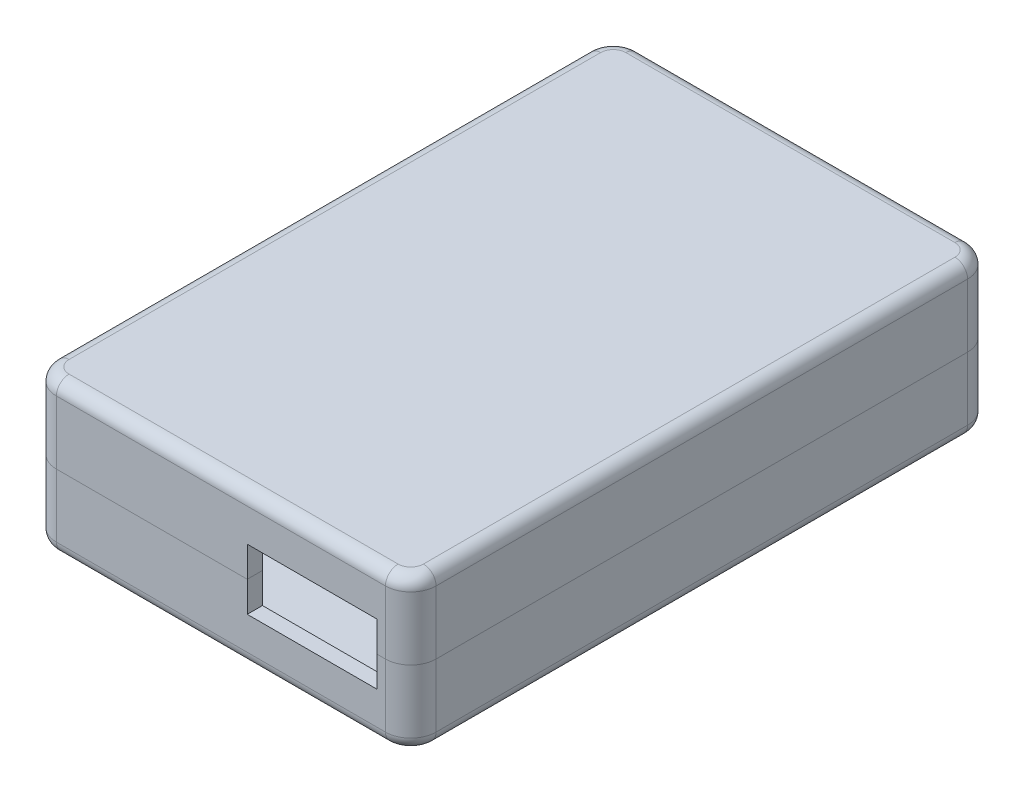
from build123d import *

# Parameters (mm, degrees)
SKETCH1_W              = 75
SKETCH1_H              = 30
BOSS_EXTRUDE1_DEPTH    = 115
FILLET1_R              = 5
FILLET2_R              = 2.5
SHELL1_T               = 3
SKETCH3_W              = 25.6
SKETCH3_H              = 12
CUT_EXTRUDE1_DEPTH     = 3
SPLIT1_SURFACE_1_BACK  = 141.535
SPLIT1_SURFACE_1_DEPTH = 283.07
SPLIT1_SURFACE_2_BACK  = 141.535
SPLIT1_SURFACE_2_DEPTH = 283.07


with BuildPart() as part:
    # Sketch1 → Boss-Extrude1 (new body)
    with BuildSketch(Plane.XY):
        Rectangle(SKETCH1_W, SKETCH1_H)
    extrude(amount=-BOSS_EXTRUDE1_DEPTH)

    # Fillet1
    fillet1_edges = [part.edges().sort_by_distance(p)[0] for p in [
        (37.5, 0, -115),
        (-37.5, 0, -115),
        (37.5, 0, 0),
        (-37.5, 0, 0),
    ]]
    fillet(fillet1_edges, radius=FILLET1_R)

    # Fillet2
    fillet2_edges = [part.edges().sort_by_distance(p)[0] for p in [
        (37.5, -15, -57.5),
        (37.5, 15, -57.5),
        (0, 15, 0),
        (0, 15, -115),
        (-37.5, 15, -57.5),
        (-36.035533906, 15, -113.535533906),
        (-36.035533906, 15, -1.464466094),
        (36.035533906, 15, -1.464466094),
        (36.035533906, 15, -113.535533906),
        (0, -15, -115),
        (0, -15, 0),
        (-37.5, -15, -57.5),
        (-36.035533906, -15, -113.535533906),
        (-36.035533906, -15, -1.464466094),
        (36.035533906, -15, -1.464466094),
        (36.035533906, -15, -113.535533906),
    ]]
    fillet(fillet2_edges, radius=FILLET2_R)

    # Shell1 (no face opened: a closed hollow body)
    add(offset(amount=-SHELL1_T, mode=Mode.PRIVATE), mode=Mode.SUBTRACT)

    # Sketch3 → Cut-Extrude1 (cut)
    with BuildSketch(Plane.XY):
        with Locations((18, 0)):
            Rectangle(SKETCH3_W, SKETCH3_H)
    extrude(amount=-CUT_EXTRUDE1_DEPTH, mode=Mode.SUBTRACT)


with BuildPart() as body_2:
    # Split1: the piece behind the surface
    add(part.part)
    # Split1 surface: a surface, the sketch's curves swept straight by 283.07 mm
    with BuildLine(Plane(origin=(0, 0, 0), x_dir=(0, 0, -1), z_dir=(1, 0, 0)).offset(-SPLIT1_SURFACE_1_BACK), mode=Mode.PRIVATE) as split1_surface_1_path:
        Line((-7.5, 0), (122.5, 0))
    split1_surface_1 = Shell.extrude(split1_surface_1_path.wire(), (1 * SPLIT1_SURFACE_1_DEPTH, 0 * SPLIT1_SURFACE_1_DEPTH, 0 * SPLIT1_SURFACE_1_DEPTH))
    split(bisect_by=split1_surface_1, keep=Keep.BOTTOM)


with BuildPart() as part_1:
    add(part.part)

    # Split1: split by a surface, the side it looks to stays
    # Split1 surface: a surface, the sketch's curves swept straight by 283.07 mm
    with BuildLine(Plane(origin=(0, 0, 0), x_dir=(0, 0, -1), z_dir=(1, 0, 0)).offset(-SPLIT1_SURFACE_2_BACK), mode=Mode.PRIVATE) as split1_surface_2_path:
        Line((-7.5, 0), (122.5, 0))
    split1_surface_2 = Shell.extrude(split1_surface_2_path.wire(), (1 * SPLIT1_SURFACE_2_DEPTH, 0 * SPLIT1_SURFACE_2_DEPTH, 0 * SPLIT1_SURFACE_2_DEPTH))
    split(bisect_by=split1_surface_2, keep=Keep.TOP)


solid = Compound([body_2.part, part_1.part])
